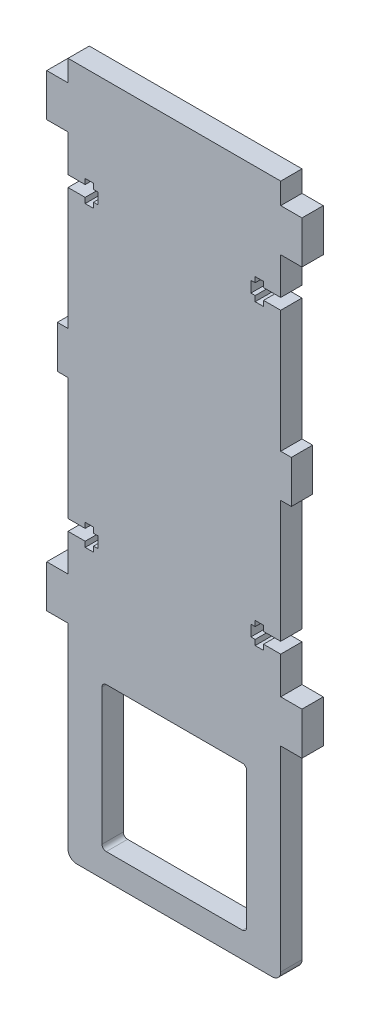
from build123d import *

# Parameters (mm, degrees)
SKETCH1_W           = 63.5
SKETCH1_H           = 152.4
BOSS_EXTRUDE1_DEPTH = 6.35
SKETCH2_W           = 3.175
SKETCH2_H           = 12.7
SKETCH2_W_2         = 6.35
BOSS_EXTRUDE3_DEPTH = 6.35
SKETCH4_W           = 8.89
SKETCH4_H           = 3.302
SKETCH4_W_2         = 2.5
SKETCH4_H_2         = 6.5
CUT_EXTRUDE4_DEPTH  = 6.35
SKETCH5_W           = 63.5
SKETCH5_H           = 50.8
SKETCH5_W_2         = 43.18
SKETCH5_H_2         = 43.18
BOSS_EXTRUDE4_DEPTH = 6.35
SKETCH7_W           = 63.5
SKETCH7_H           = 3.81
BOSS_EXTRUDE5_DEPTH = 6.35
FILLET1_R           = 2.54
FILLET2_R           = 1.27


with BuildPart() as part:
    # Sketch1 → Boss-Extrude1 (new body)
    with BuildSketch(Plane.XY):
        with Locations((31.75, 76.2)):
            Rectangle(SKETCH1_W, SKETCH1_H)
    extrude(amount=BOSS_EXTRUDE1_DEPTH)

    # Sketch2 → Boss-Extrude3 (add)
    with BuildSketch(Plane.XY.offset(6.35)):
        with Locations((-1.5875, 76.2)):
            Rectangle(SKETCH2_W, SKETCH2_H)
        with Locations((66.675, 139.7)):
            Rectangle(SKETCH2_W_2, SKETCH2_H)
        with Locations((65.0875, 76.2)):
            Rectangle(SKETCH2_W, SKETCH2_H)
        with Locations((66.675, 12.7)):
            Rectangle(SKETCH2_W_2, SKETCH2_H)
        with Locations((-3.175, 12.7)):
            Rectangle(SKETCH2_W_2, SKETCH2_H)
        with Locations((-3.175, 139.7)):
            Rectangle(SKETCH2_W_2, SKETCH2_H)
    extrude(amount=-BOSS_EXTRUDE3_DEPTH)

    # Sketch4 → Cut-Extrude4 (cut)
    with BuildSketch(Plane.XY.offset(6.35)):
        with Locations((4.445, 120.65)):
            Rectangle(SKETCH4_W, SKETCH4_H)
        with Locations((6.37, 120.65)):
            Rectangle(SKETCH4_W_2, SKETCH4_H_2)
        with Locations((6.37, 31.75)):
            Rectangle(SKETCH4_W_2, SKETCH4_H_2)
        with Locations((4.445, 31.75)):
            Rectangle(SKETCH4_W, SKETCH4_H)
        with Locations((59.055, 31.75)):
            Rectangle(SKETCH4_W, SKETCH4_H)
        with Locations((57.13, 31.75)):
            Rectangle(SKETCH4_W_2, SKETCH4_H_2)
        with Locations((57.13, 120.65)):
            Rectangle(SKETCH4_W_2, SKETCH4_H_2)
        with Locations((59.055, 120.65)):
            Rectangle(SKETCH4_W, SKETCH4_H)
    extrude(amount=-CUT_EXTRUDE4_DEPTH, mode=Mode.SUBTRACT)

    # Sketch5 → Boss-Extrude4 (add)
    with BuildSketch(Plane.XY.offset(6.35)):
        with Locations((31.75, -25.4)):
            Rectangle(SKETCH5_W, SKETCH5_H)
        with Locations((31.75, -25.4)):
            Rectangle(SKETCH5_W_2, SKETCH5_H_2, mode=Mode.SUBTRACT)
    extrude(amount=-BOSS_EXTRUDE4_DEPTH)

    # Sketch7 → Boss-Extrude5 (add)
    with BuildSketch(Plane.XY.offset(6.35)):
        with Locations((31.75, -52.705)):
            Rectangle(SKETCH7_W, SKETCH7_H)
    extrude(amount=-BOSS_EXTRUDE5_DEPTH)

    # Fillet1
    fillet1_edges = [part.edges().sort_by_distance(p)[0] for p in [
        (63.5, -54.61, 3.175),
        (0, -54.61, 3.175),
    ]]
    fillet(fillet1_edges, radius=FILLET1_R)

    # Fillet2
    fillet2_edges = [part.edges().sort_by_distance(p)[0] for p in [
        (53.34, -46.99, 3.175),
        (10.16, -46.99, 3.175),
        (10.16, -3.81, 3.175),
        (53.34, -3.81, 3.175),
    ]]
    fillet(fillet2_edges, radius=FILLET2_R)


solid = part.part
